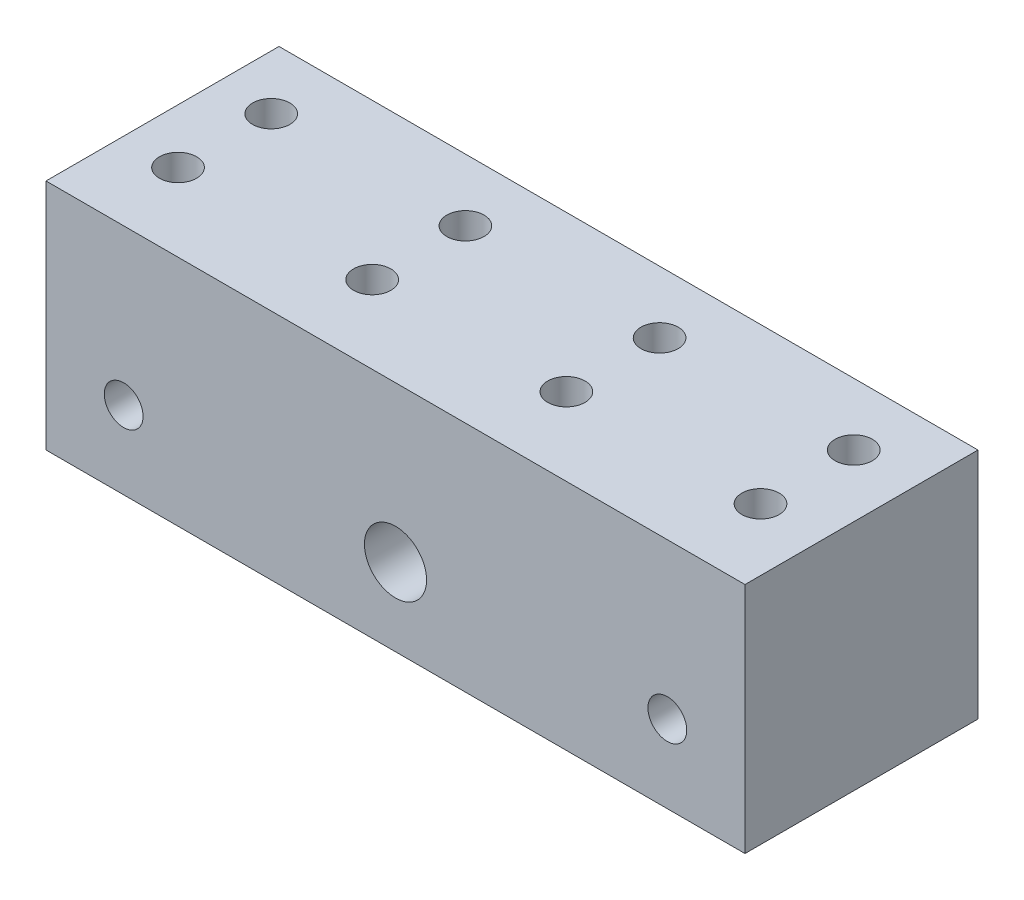
from build123d import *

# Parameters (mm, degrees)
SKETCH1_W           = 90
SKETCH1_H           = 30
SKETCH1_R           = 2.5
SKETCH1_R_2         = 4
BOSS_EXTRUDE1_DEPTH = 30
SKETCH4_R           = 2.4
CUT_EXTRUDE1_DEPTH  = 5


with BuildPart() as part:
    # Sketch1 → Boss-Extrude1 (new body)
    with BuildSketch(Plane.XY):
        with Locations((45, 15)):
            Rectangle(SKETCH1_W, SKETCH1_H)
        with Locations((10, 10)):
            Circle(SKETCH1_R, mode=Mode.SUBTRACT)
        with Locations((45, 10)):
            Circle(SKETCH1_R_2, mode=Mode.SUBTRACT)
        with Locations((80, 10)):
            Circle(SKETCH1_R, mode=Mode.SUBTRACT)
    extrude(amount=BOSS_EXTRUDE1_DEPTH)

    # Sketch4 → Cut-Extrude1 (cut)
    with BuildSketch(Plane(origin=(0, 30, 0), x_dir=(1, 0, 0), z_dir=(0, 1, 0))):
        with Locations(Location((7, -8, 0), (0, 0, 270))):
            Circle(SKETCH4_R)
        with Locations(Location((32, -8, 0), (0, 0, 270))):
            Circle(SKETCH4_R)
        with Locations(Location((57, -8, 0), (0, 0, 270))):
            Circle(SKETCH4_R)
        with Locations(Location((82, -8, 0), (0, 0, 270))):
            Circle(SKETCH4_R)
        with Locations(Location((32, -20, 0), (0, 0, 270))):
            Circle(SKETCH4_R)
        with Locations(Location((57, -20, 0), (0, 0, 270))):
            Circle(SKETCH4_R)
        with Locations(Location((82, -20, 0), (0, 0, 270))):
            Circle(SKETCH4_R)
        with Locations(Location((7, -20, 0), (0, 0, 270))):
            Circle(SKETCH4_R)
    extrude(amount=-CUT_EXTRUDE1_DEPTH, mode=Mode.SUBTRACT)


solid = part.part
